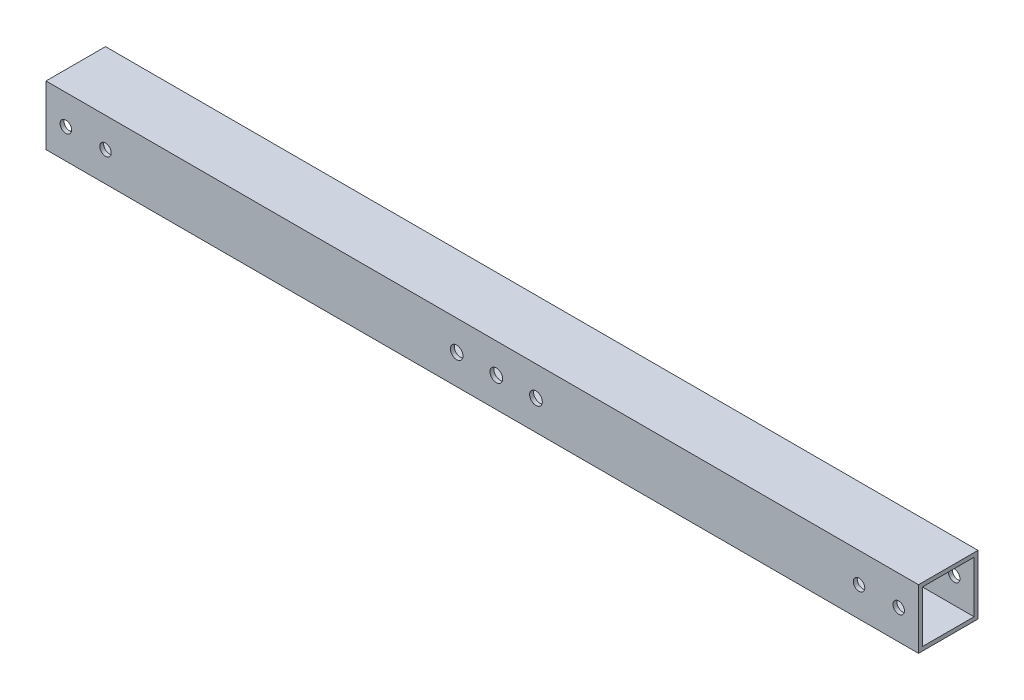
from build123d import *

# Parameters (mm, degrees)
SKETCH_1_W          = 15
SKETCH_1_H          = 15
SKETCH_1_W_2        = 13
SKETCH_1_H_2        = 13
EXTRUDE_1_DEPTH     = 220
SKETCH_2_R          = 1.45
SKETCH_2_R_2        = 1.6
CUT_EXTRUDE_1_DEPTH = 221.638278637


with BuildPart() as part:
    # 草图1 → 凸台-拉伸1 (new body)
    with BuildSketch(Plane(origin=(0, 0, 0), x_dir=(0, 0, -1), z_dir=(1, 0, 0))):
        Rectangle(SKETCH_1_W, SKETCH_1_H)
        Rectangle(SKETCH_1_W_2, SKETCH_1_H_2, mode=Mode.SUBTRACT)
    extrude(amount=EXTRUDE_1_DEPTH)

    # 草图2 → 切除-拉伸1 (cut, through all)
    with BuildSketch(Plane.XY.offset(7.5)):
        with Locations((215, 0)):
            Circle(SKETCH_2_R)
        with Locations((205, 0)):
            Circle(SKETCH_2_R)
        with Locations((123.545188216, 0)):
            Circle(SKETCH_2_R_2)
        with Locations((113.545188216, 0)):
            Circle(SKETCH_2_R_2)
        with Locations((103.545188216, 0)):
            Circle(SKETCH_2_R_2)
        with Locations((15, 0)):
            Circle(SKETCH_2_R)
        with Locations((5, 0)):
            Circle(SKETCH_2_R)
    extrude(amount=-CUT_EXTRUDE_1_DEPTH, mode=Mode.SUBTRACT)


solid = part.part
